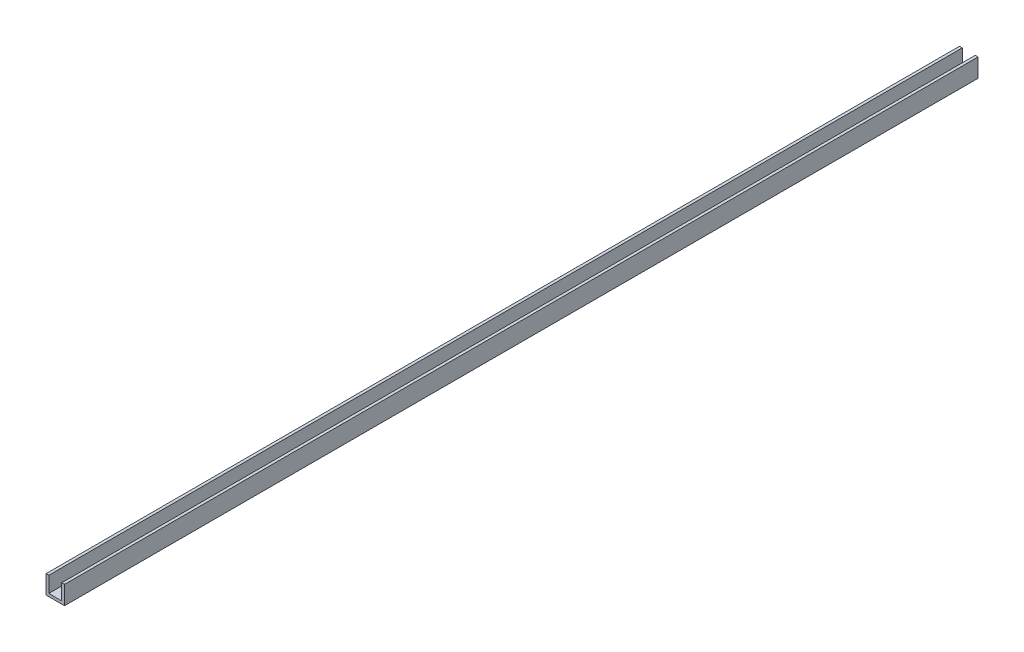
from build123d import *

# Parameters (mm, degrees)
EXTRUDE_1_DEPTH = 493


with BuildPart() as part:
    # Эскиз1 → Бобышка-Вытянуть1 (new body)
    with BuildSketch(Plane.XY):
        Polygon((0, 0), (10, 0), (10, 10), (8.5, 10), (8.5, 1.5), (1.5, 1.5), (1.5, 10), (0, 10), align=None)
    extrude(amount=EXTRUDE_1_DEPTH)


solid = part.part
